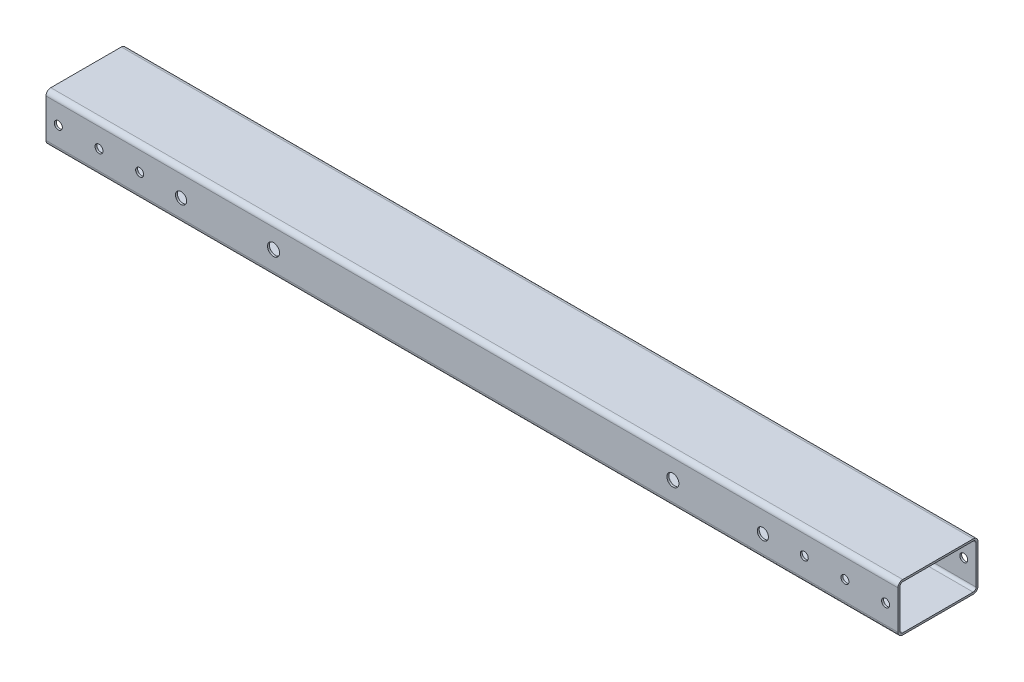
from build123d import *

# Parameters (mm, degrees)
TUBO_RETANGULAR_50_X_30_X_2_6_1_DEPTH = 532
ESBO_O2_R                             = 2.5
CORTE_EXTRUS_O1_DEPTH                 = 535.554955079
ESBO_O5_R                             = 3.75
CORTE_EXTRUS_O4_DEPTH                 = 535.554955079
ESBO_O6_R                             = 3.5
CORTE_EXTRUS_O5_DEPTH                 = 535.554955079


with BuildPart() as part:
    # Sketch1 → Tubo retangular 50 X 30 X 2.6(1) (new body)
    with BuildSketch(Plane.YZ):
        with BuildLine():
            Line((-12, -25), (12, -25))
            ThreePointArc((12, -25), (14.121320344, -24.121320344), (15, -22))
            Line((15, -22), (15, 22))
            ThreePointArc((15, 22), (14.121320344, 24.121320344), (12, 25))
            Line((12, 25), (-12, 25))
            ThreePointArc((-12, 25), (-14.121320344, 24.121320344), (-15, 22))
            Line((-15, 22), (-15, -22))
            ThreePointArc((-15, -22), (-14.121320344, -24.121320344), (-12, -25))
        make_face()
        with BuildLine():
            Line((-12, -23.8), (12, -23.8))
            ThreePointArc((12, -23.8), (13.272792206, -23.272792206), (13.8, -22))
            Line((13.8, -22), (13.8, 22))
            ThreePointArc((13.8, 22), (13.272792206, 23.272792206), (12, 23.8))
            Line((12, 23.8), (-12, 23.8))
            ThreePointArc((-12, 23.8), (-13.272792206, 23.272792206), (-13.8, 22))
            Line((-13.8, 22), (-13.8, -22))
            ThreePointArc((-13.8, -22), (-13.272792206, -23.272792206), (-12, -23.8))
        make_face(mode=Mode.SUBTRACT)
    extrude(amount=TUBO_RETANGULAR_50_X_30_X_2_6_1_DEPTH)

    # Esboço2 → Corte-extrusão1 (cut, through all)
    with BuildSketch(Plane(origin=(0, 0, -25), x_dir=(-1, 0, 0), z_dir=(0, 0, -1))):
        with Locations((-58.5, 0)):
            Circle(ESBO_O2_R)
        with Locations((-33.1, 0)):
            Circle(ESBO_O2_R)
        with Locations((-7.7, 0)):
            Circle(ESBO_O2_R)
        with Locations(Location((-524.3, 0, 0), (0, 0, 180))):
            Circle(ESBO_O2_R)
        with Locations(Location((-498.9, 0, 0), (0, 0, 180))):
            Circle(ESBO_O2_R)
        with Locations(Location((-473.5, 0, 0), (0, 0, 180))):
            Circle(ESBO_O2_R)
    extrude(amount=-CORTE_EXTRUS_O1_DEPTH, mode=Mode.SUBTRACT)

    # Esboço5 → Corte-extrusão4 (cut, through all)
    with BuildSketch(Plane(origin=(0, 0, -25), x_dir=(-1, 0, 0), z_dir=(0, 0, -1))):
        with Locations((-391.484705047, 0)):
            Circle(ESBO_O5_R)
        with Locations((-142.084705047, 0)):
            Circle(ESBO_O5_R)
    extrude(amount=-CORTE_EXTRUS_O4_DEPTH, mode=Mode.SUBTRACT)

    # Esboço6 → Corte-extrusão5 (cut, through all)
    with BuildSketch(Plane(origin=(0, 0, -25), x_dir=(-1, 0, 0), z_dir=(0, 0, -1))):
        with Locations((-447.652173256, -0.984705047)):
            Circle(ESBO_O6_R)
        with Locations((-84.347826744, -0.984705047)):
            Circle(ESBO_O6_R)
    extrude(amount=-CORTE_EXTRUS_O5_DEPTH, mode=Mode.SUBTRACT)


solid = part.part
